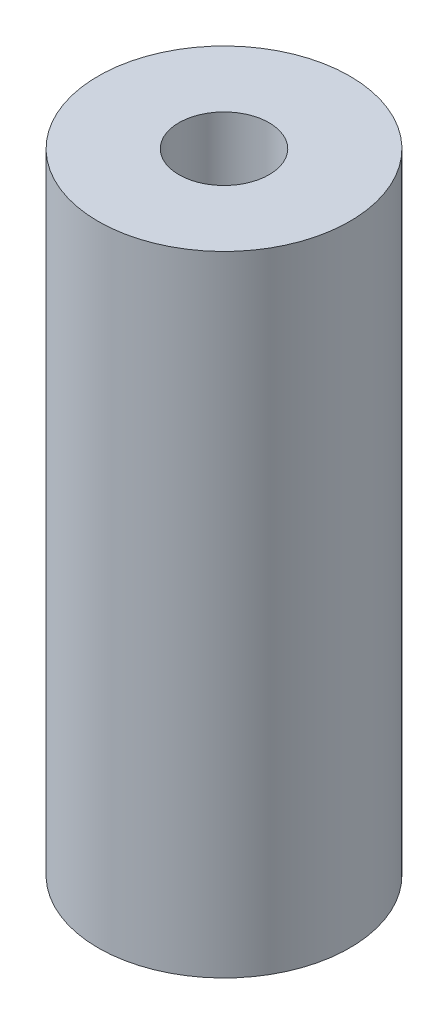
from build123d import *

# Parameters (mm, degrees)
SKETCH_1_R      = 6
SKETCH_1_R_2    = 2.15
EXTRUDE_1_DEPTH = 30


with BuildPart() as part:
    # Эскиз1 → Бобышка-Вытянуть1 (new body)
    with BuildSketch(Plane(origin=(0, 0, 0), x_dir=(1, 0, 0), z_dir=(0, 1, 0))):
        with Locations(Location((0, 0, 0), (0, 0, 270))):
            Circle(SKETCH_1_R)
        with Locations(Location((0, 0, 0), (0, 0, 270))):
            Circle(SKETCH_1_R_2, mode=Mode.SUBTRACT)
    extrude(amount=EXTRUDE_1_DEPTH)


solid = part.part
